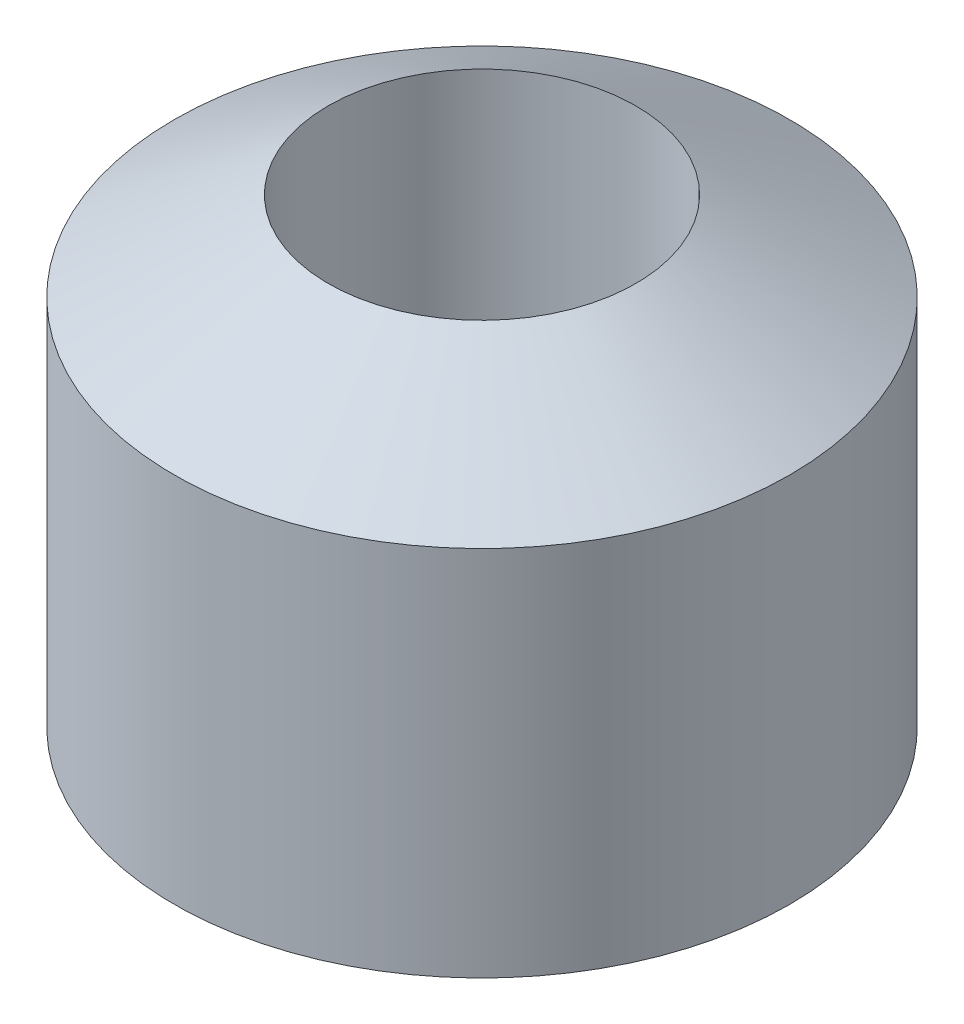
from build123d import *


with BuildPart() as part:
    # Sketch1 → Revolve1 (revolve)
    with BuildSketch(Plane.XY, mode=Mode.PRIVATE) as revolve1_sk:
        Polygon((14, 50), (14, 0), (28, 8.082903769), (28, 41.917096231), align=None)
    revolve(revolve1_sk.sketch.rotate(Axis((0, 3.980225623, 0), (0, -1, 0)), 180), axis=Axis((0, 3.980225623, 0), (0, -1, 0)))


solid = part.part
